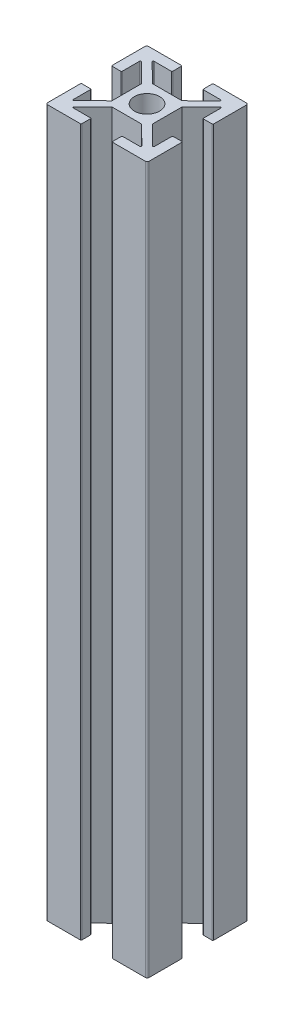
from build123d import *

# Parameters (mm, degrees)
SKETCH1_R           = 2.5
BOSS_EXTRUDE2_DEPTH = 140


with BuildPart() as part:
    # Sketch1 → Boss-Extrude2 (new body)
    with BuildSketch(Plane(origin=(0, 0, 0), x_dir=(1, 0, 0), z_dir=(0, 1, 0))):
        with BuildLine():
            Line((-9.896296296, 3), (-8.196296296, 3))
            ThreePointArc((-8.196296296, 3), (-8.090230279, 3.043933983), (-8.046296296, 3.15))
            Line((-8.046296296, 3.15), (-8.046296296, 6.586184513))
            ThreePointArc((-8.046296296, 6.586184513), (-7.954097251, 6.724600732), (-7.790842301, 6.692859041))
            Line((-7.790842301, 6.692859041), (-4, 2.945390222))
            Line((-4, 2.945390222), (-4, -2.945390222))
            Line((-4, -2.945390222), (-7.790842301, -6.692859041))
            ThreePointArc((-7.790842301, -6.692859041), (-7.954097251, -6.724600732), (-8.046296296, -6.586184513))
            Line((-8.046296296, -6.586184513), (-8.046296296, -3.15))
            ThreePointArc((-8.046296296, -3.15), (-8.090230279, -3.043933983), (-8.196296296, -3))
            Line((-8.196296296, -3), (-9.896296296, -3))
            ThreePointArc((-9.896296296, -3), (-10.002362313, -3.043933983), (-10.046296296, -3.15))
            Line((-10.046296296, -3.15), (-10.046296296, -9.65))
            ThreePointArc((-10.046296296, -9.65), (-9.94378367, -9.897487373), (-9.696296296, -10))
            Line((-9.696296296, -10), (-3.196296296, -10))
            ThreePointArc((-3.196296296, -10), (-3.090230279, -9.956066017), (-3.046296296, -9.85))
            Line((-3.046296296, -9.85), (-3.046296296, -8.15))
            ThreePointArc((-3.046296296, -8.15), (-3.090230279, -8.043933983), (-3.196296296, -8))
            Line((-3.196296296, -8), (-6.614381093, -8))
            ThreePointArc((-6.614381093, -8), (-6.753127587, -7.9070036), (-6.719835089, -7.743325472))
            Line((-6.719835089, -7.743325472), (-2.93318409, -4))
            Line((-2.93318409, -4), (2.93318409, -4))
            Line((2.93318409, -4), (6.719835089, -7.743325472))
            ThreePointArc((6.719835089, -7.743325472), (6.753127587, -7.9070036), (6.614381093, -8))
            Line((6.614381093, -8), (3.196296296, -8))
            ThreePointArc((3.196296296, -8), (3.090230279, -8.043933983), (3.046296296, -8.15))
            Line((3.046296296, -8.15), (3.046296296, -9.85))
            ThreePointArc((3.046296296, -9.85), (3.090230279, -9.956066017), (3.196296296, -10))
            Line((3.196296296, -10), (9.696296296, -10))
            ThreePointArc((9.696296296, -10), (9.94378367, -9.897487373), (10.046296296, -9.65))
            Line((10.046296296, -9.65), (10.046296296, -3.15))
            ThreePointArc((10.046296296, -3.15), (10.002362313, -3.043933983), (9.896296296, -3))
            Line((9.896296296, -3), (8.196296296, -3))
            ThreePointArc((8.196296296, -3), (8.090230279, -3.043933983), (8.046296296, -3.15))
            Line((8.046296296, -3.15), (8.046296296, -6.586184513))
            ThreePointArc((8.046296296, -6.586184513), (7.954097251, -6.724600732), (7.790842301, -6.692859041))
            Line((7.790842301, -6.692859041), (4, -2.945390222))
            Line((4, -2.945390222), (4, 2.945390222))
            Line((4, 2.945390222), (7.790842301, 6.692859041))
            ThreePointArc((7.790842301, 6.692859041), (7.954097251, 6.724600732), (8.046296296, 6.586184513))
            Line((8.046296296, 6.586184513), (8.046296296, 3.15))
            ThreePointArc((8.046296296, 3.15), (8.090230279, 3.043933983), (8.196296296, 3))
            Line((8.196296296, 3), (9.896296296, 3))
            ThreePointArc((9.896296296, 3), (10.002362313, 3.043933983), (10.046296296, 3.15))
            Line((10.046296296, 3.15), (10.046296296, 9.65))
            ThreePointArc((10.046296296, 9.65), (9.94378367, 9.897487373), (9.696296296, 10))
            Line((9.696296296, 10), (3.196296296, 10))
            ThreePointArc((3.196296296, 10), (3.090230279, 9.956066017), (3.046296296, 9.85))
            Line((3.046296296, 9.85), (3.046296296, 8.15))
            ThreePointArc((3.046296296, 8.15), (3.090230279, 8.043933983), (3.196296296, 8))
            Line((3.196296296, 8), (6.614381093, 8))
            ThreePointArc((6.614381093, 8), (6.753127587, 7.9070036), (6.719835089, 7.743325472))
            Line((6.719835089, 7.743325472), (2.93318409, 4))
            Line((2.93318409, 4), (-2.93318409, 4))
            Line((-2.93318409, 4), (-6.719835089, 7.743325472))
            ThreePointArc((-6.719835089, 7.743325472), (-6.753127587, 7.9070036), (-6.614381093, 8))
            Line((-6.614381093, 8), (-3.196296296, 8))
            ThreePointArc((-3.196296296, 8), (-3.090230279, 8.043933983), (-3.046296296, 8.15))
            Line((-3.046296296, 8.15), (-3.046296296, 9.85))
            ThreePointArc((-3.046296296, 9.85), (-3.090230279, 9.956066017), (-3.196296296, 10))
            Line((-3.196296296, 10), (-9.696296296, 10))
            ThreePointArc((-9.696296296, 10), (-9.94378367, 9.897487373), (-10.046296296, 9.65))
            Line((-10.046296296, 9.65), (-10.046296296, 3.15))
            ThreePointArc((-10.046296296, 3.15), (-10.002362313, 3.043933983), (-9.896296296, 3))
        make_face()
        with Locations(Location((0, 0, 0), (0, 0, 270))):
            Circle(SKETCH1_R, mode=Mode.SUBTRACT)
    extrude(amount=BOSS_EXTRUDE2_DEPTH)


solid = part.part
